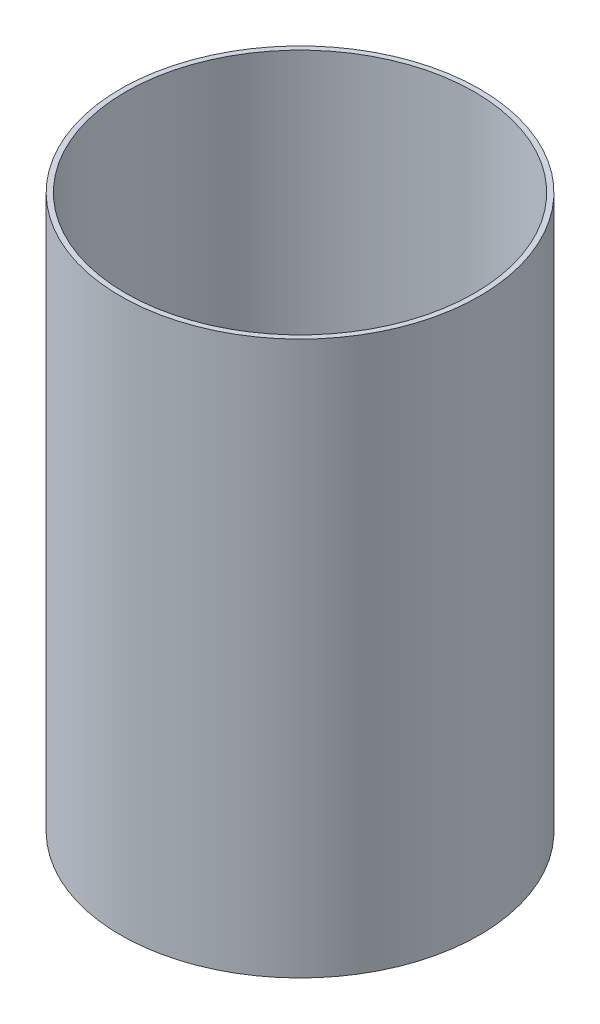
from build123d import *

# Parameters (mm, degrees)
SKETCH1_R           = 49.4538
SKETCH1_R_2         = 48.0441
BOSS_EXTRUDE1_DEPTH = 152.4


with BuildPart() as part:
    # Sketch1 → Boss-Extrude1 (new body)
    with BuildSketch(Plane(origin=(0, 0, 0), x_dir=(1, 0, 0), z_dir=(0, 1, 0))):
        with Locations(Location((0, 0, 0), (0, 0, 90))):
            Circle(SKETCH1_R)
        with Locations(Location((0, 0, 0), (0, 0, 90))):
            Circle(SKETCH1_R_2, mode=Mode.SUBTRACT)
    extrude(amount=BOSS_EXTRUDE1_DEPTH)


solid = part.part
